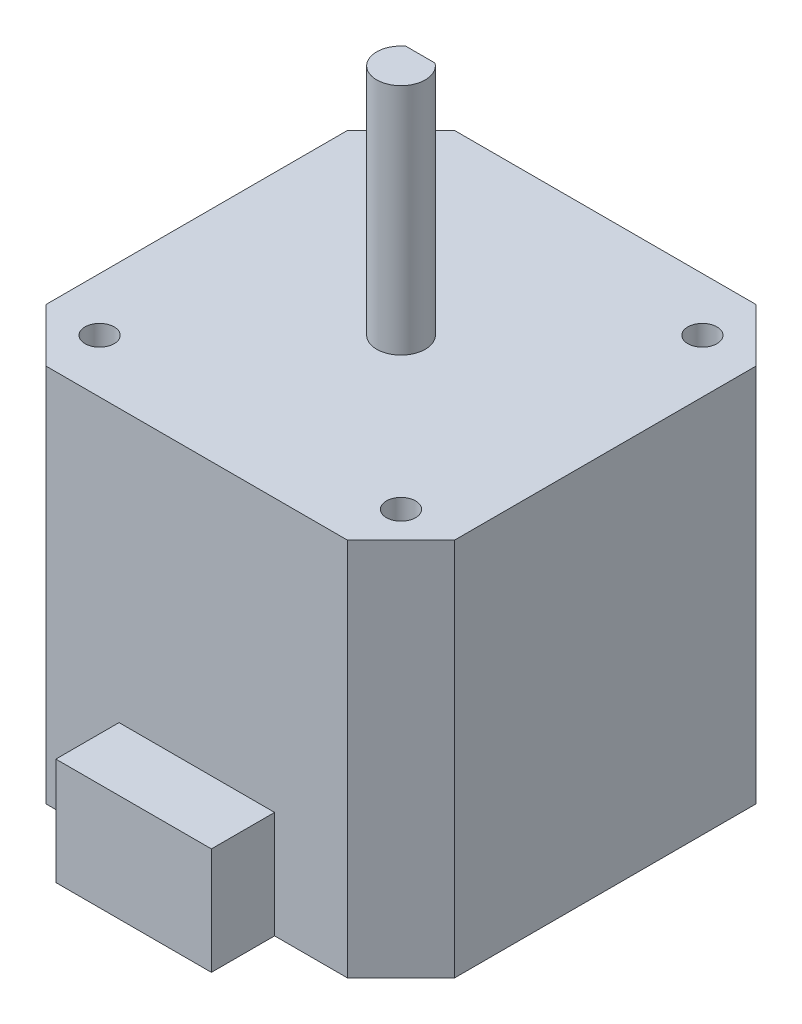
from build123d import *

# Parameters (mm, degrees)
BOSS_EXTRUDE1_DEPTH = 39
SKETCH2_R           = 2.5
BOSS_EXTRUDE2_DEPTH = 9
BOSS_EXTRUDE3_DEPTH = 15
SKETCH4_R           = 1.5
CUT_EXTRUDE1_DEPTH  = 4.5
SKETCH5_W           = 16
SKETCH5_H           = 11
BOSS_EXTRUDE4_DEPTH = 6.5


with BuildPart() as part:
    # Sketch1 → Boss-Extrude1 (new body)
    with BuildSketch(Plane(origin=(0, 0, 0), x_dir=(1, 0, 0), z_dir=(0, 1, 0))):
        Polygon((-21, 15.5), (-15.5, 21), (15.5, 21), (21, 15.5), (21, -15.5), (15.5, -21), (-15.5, -21), (-21, -15.5), align=None)
    extrude(amount=BOSS_EXTRUDE1_DEPTH)

    # Sketch2 → Boss-Extrude2 (add)
    with BuildSketch(Plane(origin=(0, 39, 0), x_dir=(1, 0, 0), z_dir=(0, 1, 0))):
        with Locations(Location((0, 0, 0), (0, 0, 90))):
            Circle(SKETCH2_R)
    extrude(amount=BOSS_EXTRUDE2_DEPTH)

    # Sketch3 → Boss-Extrude3 (add)
    with BuildSketch(Plane(origin=(0, 48, 0), x_dir=(1, 0, 0), z_dir=(0, 1, 0))):
        with BuildLine():
            Line((-1.5, 2), (1.5, 2))
            ThreePointArc((1.5, 2), (0, -2.5), (-1.5, 2))
        make_face()
    extrude(amount=BOSS_EXTRUDE3_DEPTH)

    # Sketch4 → Cut-Extrude1 (cut)
    with BuildSketch(Plane(origin=(0, 39, 0), x_dir=(1, 0, 0), z_dir=(0, 1, 0))):
        with Locations(Location((-15.5, 15.5, 0), (0, 0, 270))):
            Circle(SKETCH4_R)
        with Locations(Location((15.5, 15.5, 0), (0, 0, 270))):
            Circle(SKETCH4_R)
        with Locations(Location((15.5, -15.5, 0), (0, 0, 270))):
            Circle(SKETCH4_R)
        with Locations(Location((-15.5, -15.5, 0), (0, 0, 270))):
            Circle(SKETCH4_R)
    extrude(amount=-CUT_EXTRUDE1_DEPTH, mode=Mode.SUBTRACT)

    # Sketch5 → Boss-Extrude4 (add)
    with BuildSketch(Plane.XY.offset(21)):
        with Locations((0, 5.5)):
            Rectangle(SKETCH5_W, SKETCH5_H)
    extrude(amount=BOSS_EXTRUDE4_DEPTH)


solid = part.part
